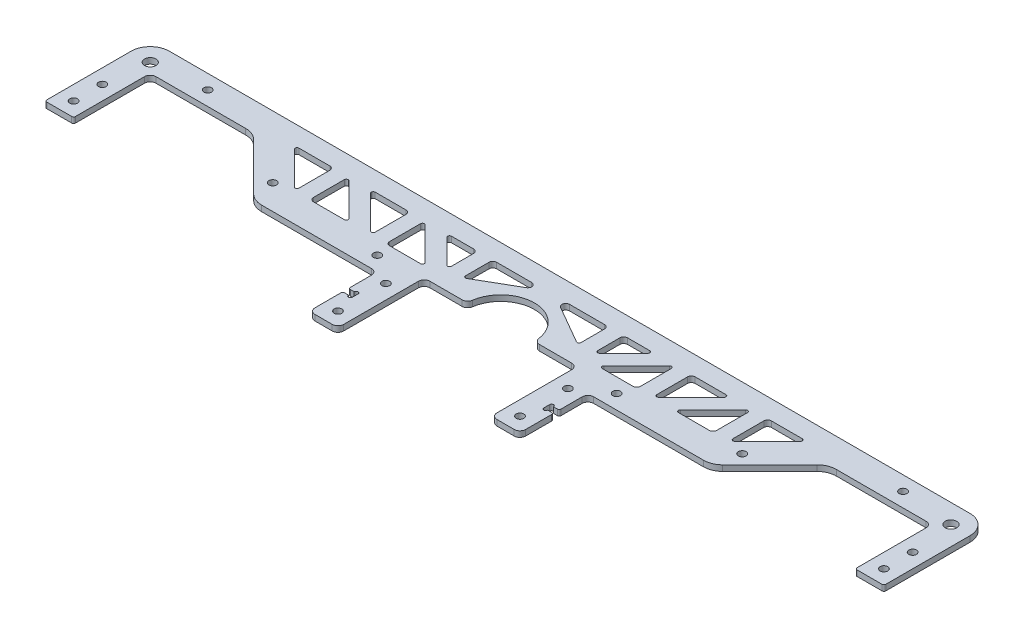
from build123d import *

# Parameters (mm, degrees)
EXTRUDE_1_DEPTH     = 3
SKETCH_2_R          = 2
SKETCH_2_W          = 80
SKETCH_2_H          = 45
SKETCH_2_W_2        = 5
SKETCH_2_H_2        = 3
CUT_EXTRUDE_1_DEPTH = 10
SKETCH_5_R          = 3
SKETCH_5_R_2        = 17.5
SKETCH_5_R_3        = 1
CUT_EXTRUDE_4_DEPTH = 234.518735865
CUT_EXTRUDE_5_DEPTH = 234.518735865
FILLET_1_R          = 10
FILLET_2_R          = 3
FILLET_3_R          = 1
FILLET_4_R          = 2


with BuildPart() as part:
    # 草图1 → 凸台-拉伸1 (new body)
    with BuildSketch(Plane(origin=(0, 0, 0), x_dir=(1, 0, 0), z_dir=(0, 1, 0))):
        with BuildLine():
            Line((-55, 0), (55, 0))
            Line((55, 0), (55, 35.5))
            Line((55, 35.5), (119.5, 35.5))
            Line((119.5, 35.5), (150, 66))
            Line((150, 66), (204, 66))
            Line((204, 66), (204, 26))
            Line((204, 26), (219, 26))
            Line((219, 26), (219, 71))
            ThreePointArc((219, 71), (216.071067812, 78.071067812), (209, 81))
            Line((209, 81), (-209, 81))
            ThreePointArc((-209, 81), (-216.071067812, 78.071067812), (-219, 71))
            Line((-219, 71), (-219, 26))
            Line((-219, 26), (-204, 26))
            Line((-204, 26), (-204, 66))
            Line((-204, 66), (-150, 66))
            Line((-150, 66), (-119.5, 35.5))
            Line((-119.5, 35.5), (-55, 35.5))
            Line((-55, 35.5), (-55, 0))
        make_face()
    extrude(amount=EXTRUDE_1_DEPTH)

    # 草图2 → 切除-拉伸1 (cut)
    with BuildSketch(Plane(origin=(0, 3, 0), x_dir=(1, 0, 0), z_dir=(0, 1, 0))):
        with Locations(Location((-47.5, 32.5, 0), (0, 0, 270))):
            Circle(SKETCH_2_R)
        with Locations(Location((-211.5, 33.5, 0), (0, 0, 270))):
            Circle(SKETCH_2_R)
        with Locations(Location((-211.5, 48.5, 0), (0, 0, 270))):
            Circle(SKETCH_2_R)
        with Locations(Location((211.5, 48.5, 0), (0, 0, 270))):
            Circle(SKETCH_2_R)
        with Locations(Location((211.5, 33.5, 0), (0, 0, 270))):
            Circle(SKETCH_2_R)
        with Locations(Location((-181.5, 73.5, 0), (0, 0, 270))):
            Circle(SKETCH_2_R)
        with Locations(Location((181.5, 73.5, 0), (0, 0, 270))):
            Circle(SKETCH_2_R)
        with Locations(Location((47.5, 32.5, 0), (0, 0, 270))):
            Circle(SKETCH_2_R)
        with Locations(Location((-47.5, 7.5, 0), (0, 0, 270))):
            Circle(SKETCH_2_R)
        with Locations(Location((-62.5, 43, 0), (0, 0, 270))):
            Circle(SKETCH_2_R)
        with Locations(Location((-122.5, 48.5, 0), (0, 0, 270))):
            Circle(SKETCH_2_R)
        with Locations(Location((62.5, 43, 0), (0, 0, 270))):
            Circle(SKETCH_2_R)
        with Locations(Location((122.5, 48.5, 0), (0, 0, 270))):
            Circle(SKETCH_2_R)
        with Locations(Location((47.5, 7.5, 0), (0, 0, 270))):
            Circle(SKETCH_2_R)
        with Locations((0, 22.5)):
            Rectangle(SKETCH_2_W, SKETCH_2_H)
        with Locations((52.5, 19)):
            Rectangle(SKETCH_2_W_2, SKETCH_2_H_2)
        with Locations((-52.5, 19)):
            Rectangle(SKETCH_2_W_2, SKETCH_2_H_2)
    extrude(amount=-CUT_EXTRUDE_1_DEPTH, mode=Mode.SUBTRACT)

    # 草图5 → 切除-拉伸4 (cut, through all)
    with BuildSketch(Plane(origin=(0, 3, 0), x_dir=(1, 0, 0), z_dir=(0, 1, 0))):
        with Locations(Location((-209, 71, 0), (0, 0, 270))):
            Circle(SKETCH_5_R)
        with Locations(Location((209, 71, 0), (0, 0, 90))):
            Circle(SKETCH_5_R)
        with Locations((0, 45)):
            Circle(SKETCH_5_R_2)
        with Locations((-51, 20.5)):
            Circle(SKETCH_5_R_3)
        with Locations((-51, 17.5)):
            Circle(SKETCH_5_R_3)
        with Locations((51, 17.5)):
            Circle(SKETCH_5_R_3)
        with Locations((51, 20.5)):
            Circle(SKETCH_5_R_3)
    extrude(amount=-CUT_EXTRUDE_4_DEPTH, mode=Mode.SUBTRACT)

    # 草图6 → 切除-拉伸5 (cut, through all)
    with BuildSketch(Plane(origin=(0, 3, 0), x_dir=(1, 0, 0), z_dir=(0, 1, 0))):
        Polygon((-133.786796564, 71), (-113.286796564, 71), (-113.286796564, 50.5), align=None)
        Polygon((-105.286796564, 50.5), (-105.286796564, 71), (-84.786796564, 50.5), align=None)
        with BuildLine():
            Line((-30.159379566, 71), (-9.91066826, 71))
            ThreePointArc((-9.91066826, 71), (-7.978816608, 69.51763809), (-8.91066826, 67.267949192))
            Line((-8.91066826, 67.267949192), (-30.159379566, 55))
            Line((-30.159379566, 55), (-30.159379566, 71))
        make_face()
        Polygon((84.786796564, 50.5), (105.286796564, 50.5), (105.286796564, 71), align=None)
        Polygon((113.286796564, 50.5), (133.786796564, 71), (113.286796564, 71), align=None)
        Polygon((-93.973088065, 71), (-73.473088065, 71), (-73.473088065, 50.5), align=None)
        Polygon((-65.473088065, 50.5), (-65.473088065, 71), (-44.973088065, 50.5), align=None)
        Polygon((-54.159379566, 71), (-38.159379566, 71), (-38.159379566, 55), align=None)
        Polygon((38.159379566, 55), (54.159379566, 71), (38.159379566, 71), align=None)
        Polygon((44.973088065, 50.5), (65.473088065, 50.5), (65.473088065, 71), align=None)
        Polygon((73.473088065, 50.5), (93.973088065, 71), (73.473088065, 71), align=None)
        with BuildLine():
            Line((30.159379566, 55), (30.159379566, 71))
            Line((30.159379566, 71), (9.91066826, 71))
            ThreePointArc((9.91066826, 71), (7.978816608, 69.51763809), (8.91066826, 67.267949192))
            Line((8.91066826, 67.267949192), (30.159379566, 55))
        make_face()
    extrude(amount=-CUT_EXTRUDE_5_DEPTH, mode=Mode.SUBTRACT)

    # 圆角1
    fillet_1_edges = [part.edges().sort_by_distance(p)[0] for p in [
        (-119.5, 1.5, -35.5),
        (-150, 1.5, -66),
        (150, 1.5, -66),
        (119.5, 1.5, -35.5),
    ]]
    fillet(fillet_1_edges, radius=FILLET_1_R)

    # 圆角2
    fillet_2_edges = [part.edges().sort_by_distance(p)[0] for p in [
        (17.5, 1.5, -45),
        (-17.5, 1.5, -45),
        (55, 1.5, 0),
        (-55, 1.5, 0),
        (-55, 1.5, -35.5),
        (-204, 1.5, -66),
        (204, 1.5, -66),
        (55, 1.5, -35.5),
        (-40, 1.5, 0),
        (-40, 1.5, -45),
        (40, 1.5, -45),
        (40, 1.5, 0),
    ]]
    fillet(fillet_2_edges, radius=FILLET_2_R)

    # 圆角3
    fillet_3_edges = [part.edges().sort_by_distance(p)[0] for p in [
        (55, 1.5, -17.5),
        (55, 1.5, -20.5),
        (-55, 1.5, -17.5),
        (-55, 1.5, -20.5),
        (-113.286796564, 1.5, -50.5),
        (-133.786796564, 1.5, -71),
        (113.286796564, 1.5, -50.5),
        (133.786796564, 1.5, -71),
        (84.786796564, 1.5, -50.5),
        (105.286796564, 1.5, -71),
        (30.159379566, 1.5, -55),
        (-38.159379566, 1.5, -55),
        (-54.159379566, 1.5, -71),
        (-204, 1.5, -26),
        (-219, 1.5, -26),
        (-73.473088065, 1.5, -50.5),
        (-93.973088065, 1.5, -71),
        (219, 1.5, -26),
        (204, 1.5, -26),
        (-30.159379566, 1.5, -55),
        (-84.786796564, 1.5, -50.5),
        (-105.286796564, 1.5, -71),
        (73.473088065, 1.5, -50.5),
        (93.973088065, 1.5, -71),
        (44.973088065, 1.5, -50.5),
        (65.473088065, 1.5, -71),
        (38.159379566, 1.5, -55),
        (54.159379566, 1.5, -71),
        (-44.973088065, 1.5, -50.5),
        (-65.473088065, 1.5, -71),
    ]]
    fillet(fillet_3_edges, radius=FILLET_3_R)

    # 圆角4
    fillet_4_edges = [part.edges().sort_by_distance(p)[0] for p in [
        (-113.286796564, 1.5, -71),
        (113.286796564, 1.5, -71),
        (105.286796564, 1.5, -50.5),
        (30.159379566, 1.5, -71),
        (-38.159379566, 1.5, -71),
        (-73.473088065, 1.5, -71),
        (-30.159379566, 1.5, -71),
        (-105.286796564, 1.5, -50.5),
        (73.473088065, 1.5, -71),
        (65.473088065, 1.5, -50.5),
        (38.159379566, 1.5, -71),
        (-65.473088065, 1.5, -50.5),
    ]]
    fillet(fillet_4_edges, radius=FILLET_4_R)


solid = part.part
